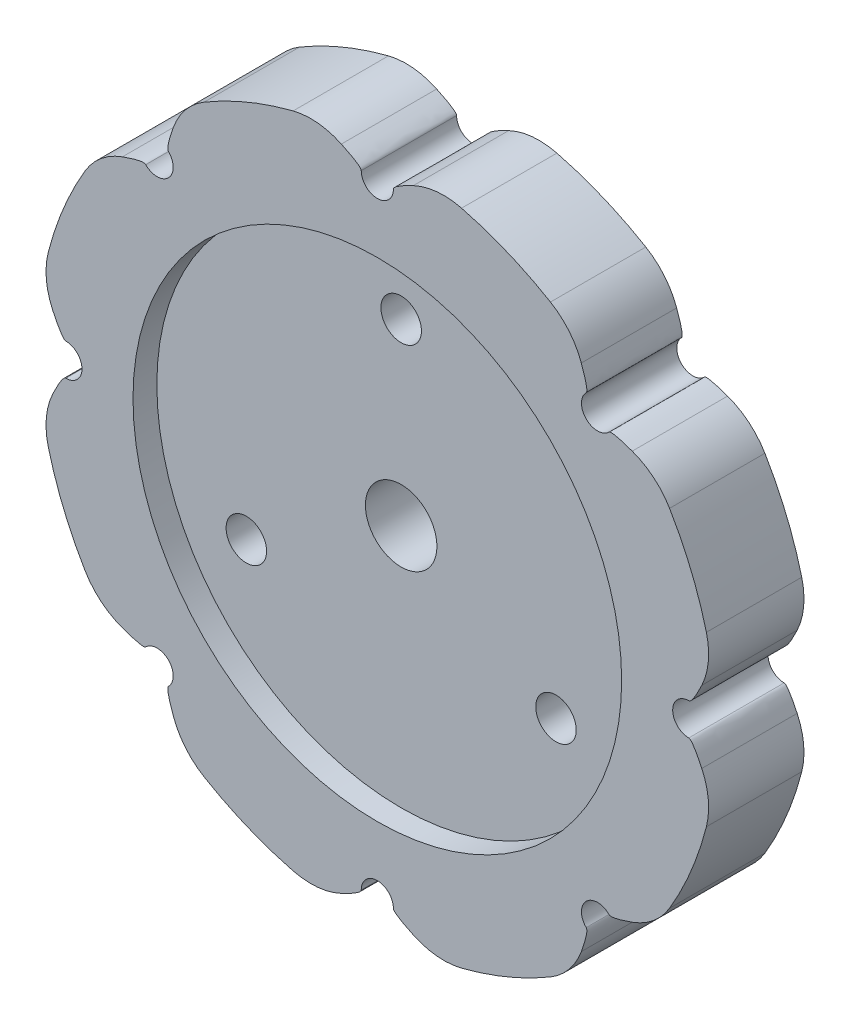
from build123d import *

# Parameters (mm, degrees)
ESQUISSE1_R                        = 28.5
BOSS_EXTRU_1_DEPTH                 = 4
ENL_V_MAT_EXTRU_1_DEPTH            = 41.503086302
CONG_1_R                           = 6
R_P_TITION_CIRCULAIRE1_COUNT       = 8
CONG_1_OF_R_P_TITION_CIRCULAIRE1_R = 6
DIAM_TRE_DU_PER_AGE_6_0_6_1_D      = 6
D_GAGEMENT_M31_D                   = 3.4
ESQUISSE9_R                        = 20.5
ENL_V_MAT_EXTRU_2_DEPTH            = 2


with BuildPart() as part:
    # Esquisse1 → Boss.-Extru.1 (new, symmetric)
    with BuildSketch(Plane.XY):
        Circle(ESQUISSE1_R)
    extrude(amount=BOSS_EXTRU_1_DEPTH, both=True)

    # Esquisse2 → Enlèv. mat.-Extru.1 (cut, symmetric)
    with BuildSketch(Plane.XY):
        with BuildLine():
            ThreePointArc((-1.35, 26.131259298), (0, 24.781259298), (1.35, 26.131259298))
            add(Edge.make_bspline(
                [(1.35, 26.131259298), (1.35, 26.580785033), (4.948973064, 28.067020961)],
                knots=[0, 0, 0, 1, 1, 1], degree=2))
            ThreePointArc((4.948973064, 28.067020961), (0, 28.5), (-4.948973064, 28.067020961))
            add(Edge.make_bspline(
                [(-1.35, 26.131259298), (-1.35, 26.580785033), (-4.948973064, 28.067020961)],
                knots=[0, 0, 0, 1, 1, 1], degree=2))
        make_face()
    enl_v_mat_extru_1 = extrude(amount=ENL_V_MAT_EXTRU_1_DEPTH, both=True, mode=Mode.SUBTRACT)

    # Congé1
    cong_1_edges = [part.edges().sort_by_distance(p)[0] for p in [
        (4.948973064, 28.067020961, -2),
        (-4.948973064, 28.067020961, 2),
    ]]
    fillet(cong_1_edges, radius=CONG_1_R)

    # Répétition circulaire1: Enlèv. mat.-Extru.1 ×8 about axis
    r_p_tition_circulaire1_axis = Axis((0, 0, 5.797806119), (0, 0, -1))
    for i in range(1, R_P_TITION_CIRCULAIRE1_COUNT):
        add(enl_v_mat_extru_1.rotate(r_p_tition_circulaire1_axis, i * 360 / R_P_TITION_CIRCULAIRE1_COUNT), mode=Mode.SUBTRACT)

    # Congé1 of Répétition circulaire1
    cong_1_of_r_p_tition_circulaire1_edges = [part.edges().sort_by_distance(p)[0] for p in [
        (23.345833262, 16.346928436, -2),
        (16.346928436, 23.345833262, 2),
        (28.067020961, -4.948973064, -2),
        (28.067020961, 4.948973064, 2),
        (16.346928436, -23.345833262, -2),
        (23.345833262, -16.346928436, 2),
        (-4.948973064, -28.067020961, -2),
        (4.948973064, -28.067020961, 2),
        (-23.345833262, -16.346928436, -2),
        (-16.346928436, -23.345833262, 2),
        (-28.067020961, 4.948973064, -2),
        (-28.067020961, -4.948973064, 2),
        (-16.346928436, 23.345833262, -2),
        (-23.345833262, 16.346928436, 2),
    ]]
    fillet(cong_1_of_r_p_tition_circulaire1_edges, radius=CONG_1_OF_R_P_TITION_CIRCULAIRE1_R)

    # Diamètre du perçage Ø6.0 (6)1 (through all)
    with Locations(Plane.XY.offset(4)):
        with Locations((0, 0)):
            Hole(DIAM_TRE_DU_PER_AGE_6_0_6_1_D / 2)

    # Dégagement M31 (through all)
    with Locations(Plane.XY.offset(4)):
        with Locations((0, 15), (-12.990381057, -7.5), (12.990381057, -7.5)):
            Hole(D_GAGEMENT_M31_D / 2)

    # Esquisse9 → Enlèv. mat.-Extru.2 (cut)
    with BuildSketch(Plane.XY.offset(4)):
        Circle(ESQUISSE9_R)
    extrude(amount=-ENL_V_MAT_EXTRU_2_DEPTH, mode=Mode.SUBTRACT)


solid = part.part
